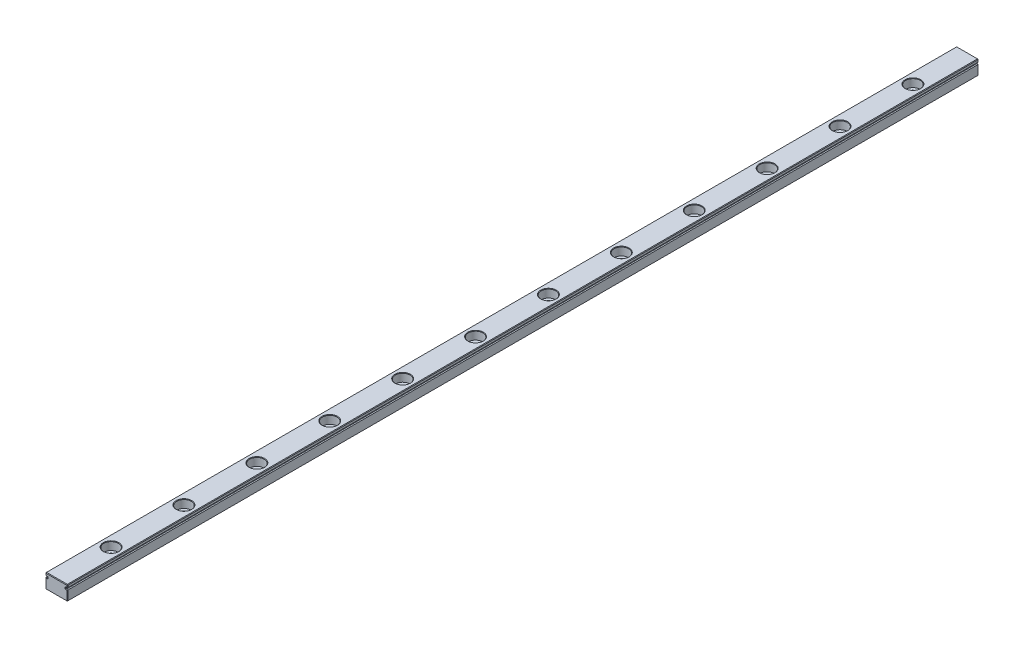
from build123d import *

# Parameters (mm, degrees)
BOSS_EXTRUDE1_DEPTH = 500
CHAMFER1_SIZE       = 0.3
LPATTERN1_COUNT     = 12
LPATTERN1_PITCH     = 40


with BuildPart() as part:
    # Sketch1 → Boss-Extrude1 (new body)
    with BuildSketch(Plane.XY):
        with BuildLine():
            Line((0, 8), (12, 8))
            Line((12, 8), (12, 6.75))
            Line((12, 6.75), (12, 6.559016994))
            ThreePointArc((12, 6.559016994), (11.706107374, 6.475528258), (11.5, 6.25))
            Line((11.5, 6.25), (11, 6.25))
            Line((11, 6.25), (11, 5.75))
            Line((11, 5.75), (11.5, 5.75))
            ThreePointArc((11.5, 5.75), (11.706107374, 5.524471742), (12, 5.440983006))
            Line((12, 5.440983006), (12, 5.25))
            Line((12, 5.25), (12, 0))
            Line((12, 0), (0, 0))
            Line((0, 0), (0, 5.25))
            Line((0, 5.25), (0, 5.440983006))
            ThreePointArc((0, 5.440983006), (0.293892626, 5.524471742), (0.5, 5.75))
            Line((0.5, 5.75), (1, 5.75))
            Line((1, 5.75), (1, 6.25))
            Line((1, 6.25), (0.5, 6.25))
            ThreePointArc((0.5, 6.25), (0.293892626, 6.475528258), (0, 6.559016994))
            Line((0, 6.559016994), (0, 6.75))
            Line((0, 6.75), (0, 8))
        make_face()
    extrude(amount=BOSS_EXTRUDE1_DEPTH)

    # Chamfer1
    chamfer1_edges = [part.edges().sort_by_distance(p)[0] for p in [
        (12, 2.720491503, 500),
        (11.706107374, 5.524471742, 500),
        (0, 2.720491503, 0),
        (0.293892626, 5.524471742, 0),
        (0.75, 5.75, 0),
        (1, 6, 0),
        (0.75, 6.25, 0),
        (11.25, 5.75, 500),
        (0.293892626, 6.475528258, 0),
        (0, 7.279508497, 0),
        (6, 8, 0),
        (12, 7.279508497, 0),
        (11.706107374, 6.475528258, 0),
        (11, 6, 500),
        (11.25, 6.25, 0),
        (11, 6, 0),
        (11.25, 5.75, 0),
        (11.706107374, 5.524471742, 0),
        (12, 2.720491503, 0),
        (6, 0, 0),
        (11.25, 6.25, 500),
        (11.706107374, 6.475528258, 500),
        (12, 7.279508497, 500),
        (0, 8, 250),
        (12, 8, 250),
        (12, 0, 250),
        (0, 0, 250),
        (6, 8, 500),
        (0, 2.720491503, 500),
        (0, 7.279508497, 500),
        (0.293892626, 6.475528258, 500),
        (0.75, 6.25, 500),
        (1, 6, 500),
        (0.75, 5.75, 500),
        (0.293892626, 5.524471742, 500),
        (6, 0, 500),
    ]]
    chamfer(chamfer1_edges, length=CHAMFER1_SIZE)

    # Sketch3 → CBORE for M5 Hex Head Bolt1 (revolve, cut)
    with BuildSketch(Plane(origin=(6, 8, 30), x_dir=(0, 0, 1), z_dir=(1, 0, 0))):
        Polygon((0, 0), (0, 8), (2.5, 8), (2.25, 7.75), (2.25, 4.5), (4, 4.5), (4, 0.25), (4.25, 0), align=None)
    cbore_for_m5_hex_head_bolt1 = revolve(axis=Axis((6, 14.35, 30), (0, -1, 0)), mode=Mode.SUBTRACT)

    # LPattern1: CBORE for M5 Hex Head Bolt1 ×12
    with Locations(*[(0, 0, i * LPATTERN1_PITCH) for i in range(1, LPATTERN1_COUNT)]):
        add(cbore_for_m5_hex_head_bolt1, mode=Mode.SUBTRACT)


solid = part.part
